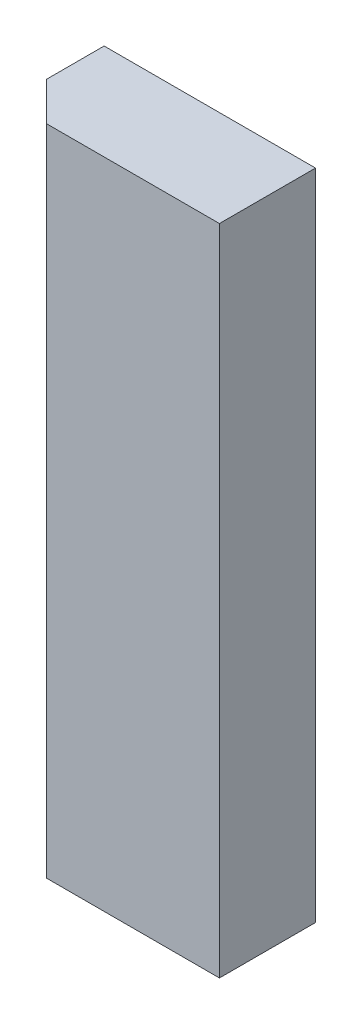
from build123d import *

# Parameters (mm, degrees)
SKETCH1_W           = 170
SKETCH1_H           = 55
BOSS_EXTRUDE1_DEPTH = 25
CHAMFER1_SIZE       = 10


with BuildPart() as part:
    # Sketch1 → Boss-Extrude1 (new body)
    with BuildSketch(Plane(origin=(0, 0, 0), x_dir=(0, 1, 0), z_dir=(0, 0, 1))):
        with Locations((85, 27.5)):
            Rectangle(SKETCH1_W, SKETCH1_H)
    extrude(amount=BOSS_EXTRUDE1_DEPTH)

    # Chamfer1
    chamfer1_edges = [part.edges().sort_by_distance(p)[0] for p in [
        (-55, 85, 25),
    ]]
    chamfer(chamfer1_edges, length=CHAMFER1_SIZE)


solid = part.part
